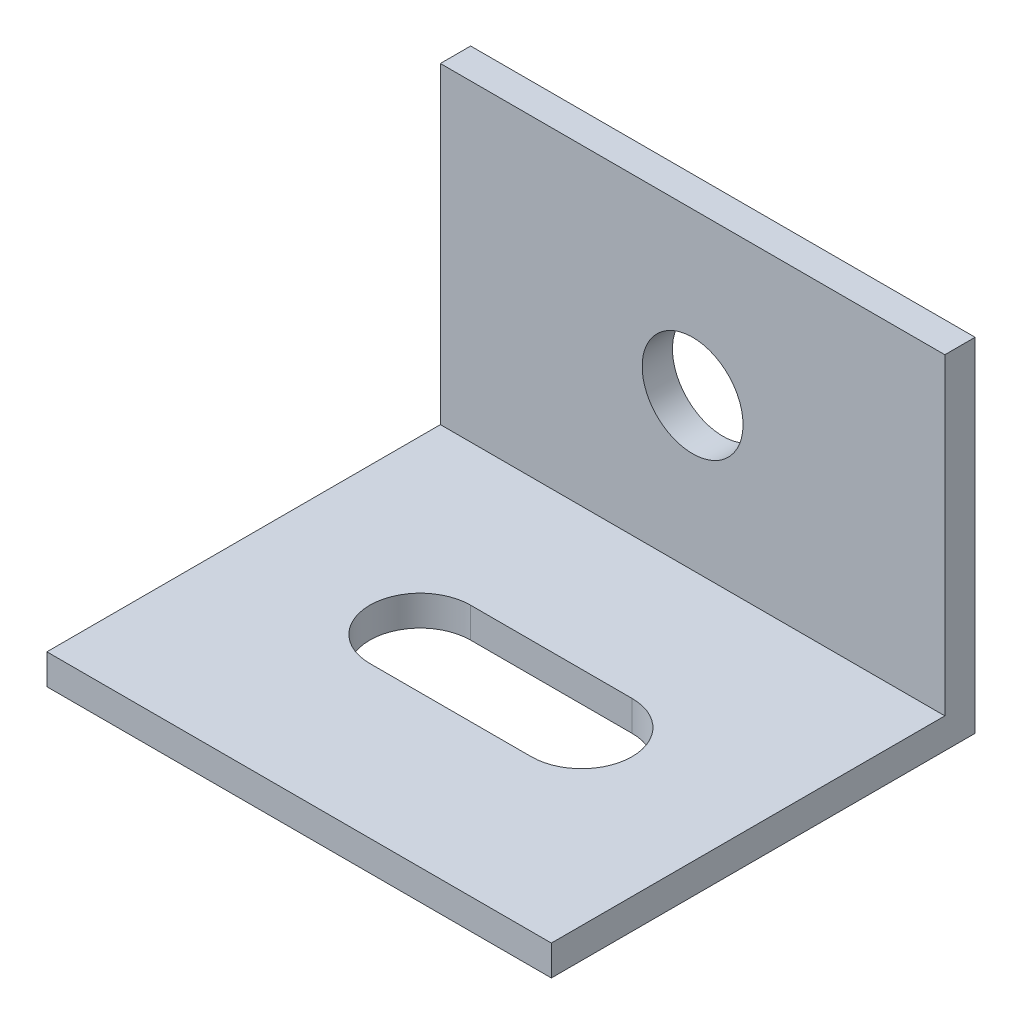
from build123d import *

# Parameters (mm, degrees)
SKETCH_1_W          = 25
SKETCH_1_H          = 17
SKETCH_1_R          = 2.5
EXTRUDE_1_DEPTH     = 1.5
SKETCH_2_W          = 25
SKETCH_2_H          = 1.5
EXTRUDE_2_DEPTH     = 19.5
CUT_EXTRUDE_1_DEPTH = 19.5


with BuildPart() as part:
    # 스케치1 → 보스-돌출1 (new body)
    with BuildSketch(Plane.XY):
        with Locations((12.5, 8.5)):
            Rectangle(SKETCH_1_W, SKETCH_1_H)
        with Locations((12.5, 9)):
            Circle(SKETCH_1_R, mode=Mode.SUBTRACT)
    extrude(amount=EXTRUDE_1_DEPTH)

    # 스케치2 → 보스-돌출2 (add)
    with BuildSketch(Plane.XY.offset(1.5)):
        with Locations((12.5, 0.75)):
            Rectangle(SKETCH_2_W, SKETCH_2_H)
    extrude(amount=EXTRUDE_2_DEPTH)

    # 스케치3 → 컷-돌출1 (cut)
    with BuildSketch(Plane(origin=(0, 1.5, 0), x_dir=(1, 0, 0), z_dir=(0, 1, 0))):
        with BuildLine():
            Line((8.5, -8.5), (16.5, -8.5))
            ThreePointArc((16.5, -8.5), (19, -11), (16.5, -13.5))
            Line((16.5, -13.5), (8.5, -13.5))
            ThreePointArc((8.5, -13.5), (6, -11), (8.5, -8.5))
        make_face()
    extrude(amount=-CUT_EXTRUDE_1_DEPTH, mode=Mode.SUBTRACT)


solid = part.part
